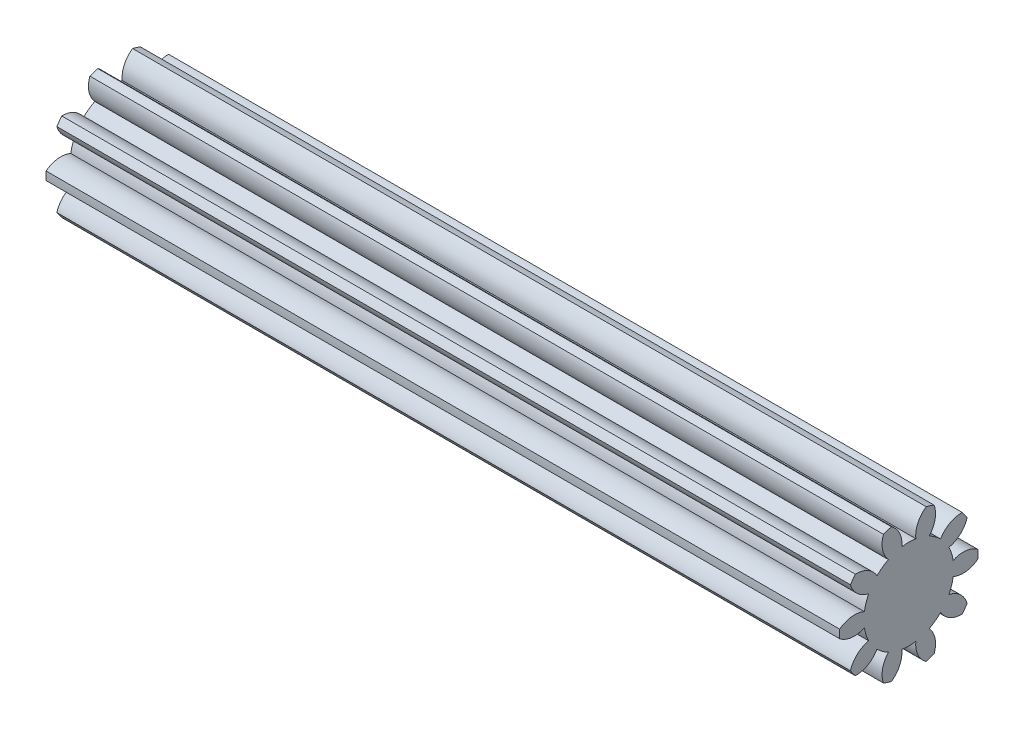
from build123d import *

# Parameters (mm, degrees)
BASPROSKE_W        = 132.288
BASPROSKE_H        = 12
TOOTHCUT_DEPTH     = 134.372092073
TEETHCUTS_COUNT    = 10
TEETHCUTS_ANGLE    = 324
BORSKE_R           = 0.4
BORE_DEPTH         = 50.0000508
SKETCH1_R          = 15.199839534
SKETCH1_R_2        = 11.537985571
CUT_EXTRUDE1_DEPTH = 134.327124963
SCALE1_SCALE       = 0.4


with BuildPart() as part:
    # BasProSke → Base-Revolve (revolve)
    with BuildSketch(Plane(origin=(0, 0, 0), x_dir=(1, 0, 0), z_dir=(0, 1, 0)), mode=Mode.PRIVATE) as base_revolve_sk:
        with Locations((66.144, 6)):
            Rectangle(BASPROSKE_W, BASPROSKE_H)
    revolve(base_revolve_sk.sketch.rotate(Axis((-10, 0, 0), (1, 0, 0)), 180), axis=Axis((-10, 0, 0), (1, 0, 0)))

    # TooCutSke → ToothCut (cut, through all)
    with BuildSketch(Plane(origin=(0, 0, 0), x_dir=(0, 0, -1), z_dir=(1, 0, 0))):
        with BuildLine():
            ThreePointArc((1.173662691, 7.406586048), (0, 7.499), (-1.173662691, 7.406586048))
            ThreePointArc((-1.173662691, 7.406586048), (-1.668191438, 9.834565786), (-3.497907776, 11.50542856))
            ThreePointArc((-3.497907776, 11.50542856), (0, 12.0254), (3.497907776, 11.50542856))
            ThreePointArc((3.497907776, 11.50542856), (1.668191438, 9.834565786), (1.173662691, 7.406586048))
        make_face()
    toothcut = extrude(amount=TOOTHCUT_DEPTH, mode=Mode.SUBTRACT)

    # TeethCuts: ToothCut ×10 about axis
    teethcuts_axis = Axis((-10, 0, 0), (1, 0, 0))
    for i in range(1, TEETHCUTS_COUNT):
        add(toothcut.rotate(teethcuts_axis, i * TEETHCUTS_ANGLE / (TEETHCUTS_COUNT - 1)), mode=Mode.SUBTRACT)

    # BorSke → Bore (cut, symmetric)
    with BuildSketch(Plane(origin=(0, 0, 0), x_dir=(0, 0, -1), z_dir=(1, 0, 0))):
        Circle(BORSKE_R)
    extrude(amount=BORE_DEPTH, both=True, mode=Mode.SUBTRACT)

    # Sketch1 → Cut-Extrude1 (cut, through all)
    with BuildSketch(Plane(origin=(132.288, 0, 0), x_dir=(0, 0, -1), z_dir=(1, 0, 0))):
        Circle(SKETCH1_R)
        Circle(SKETCH1_R_2, mode=Mode.SUBTRACT)
    extrude(amount=-CUT_EXTRUDE1_DEPTH, mode=Mode.SUBTRACT)


with BuildPart() as part_1:
    # Scale1: scaled about (0, 0, 0)
    add(part.part.scale(SCALE1_SCALE))


solid = part_1.part
